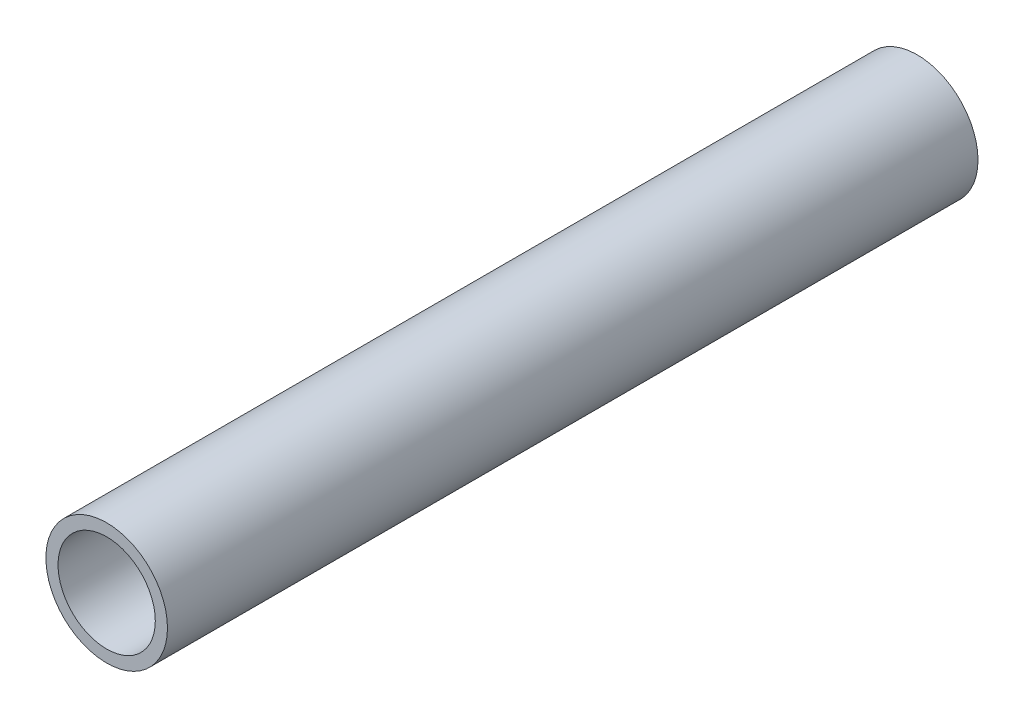
from build123d import *

# Parameters (mm, degrees)
SZKIC1_R                    = 15
SZKIC1_R_2                  = 12
DODANIE_WYCI_GNI_CIE1_DEPTH = 200


with BuildPart() as part:
    # Szkic1 → Dodanie-wyciągnięcie1 (new body)
    with BuildSketch(Plane.XY):
        Circle(SZKIC1_R)
        Circle(SZKIC1_R_2, mode=Mode.SUBTRACT)
    extrude(amount=DODANIE_WYCI_GNI_CIE1_DEPTH)


solid = part.part
